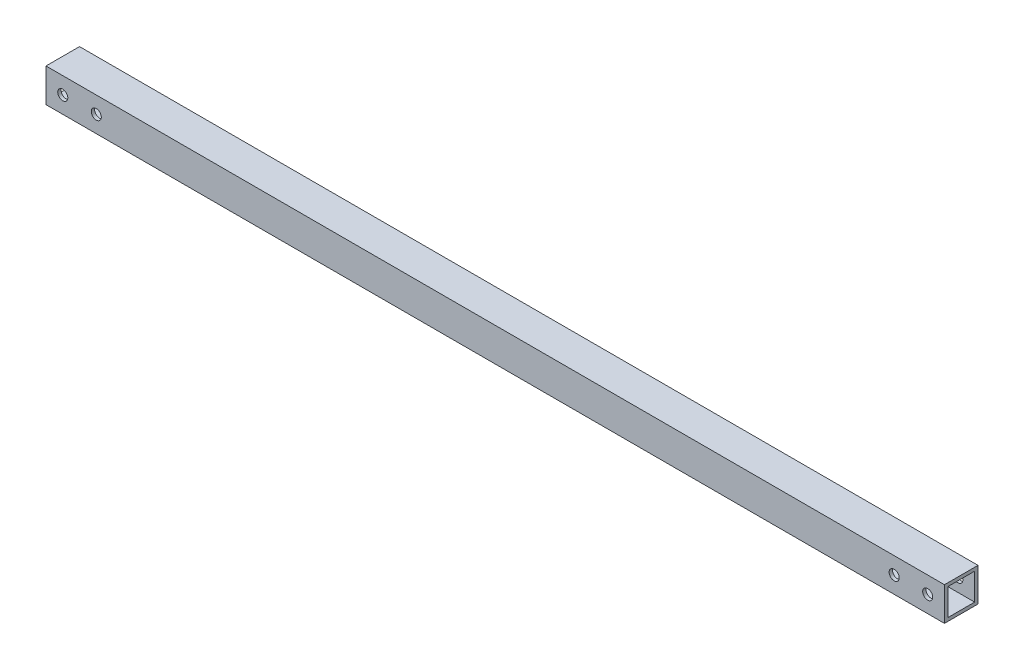
from build123d import *

# Parameters (mm, degrees)
SKETCH1_W           = 20
SKETCH1_H           = 20
SKETCH1_W_2         = 16
SKETCH1_H_2         = 16
BOSS_EXTRUDE1_DEPTH = 268
SKETCH2_R           = 3
CUT_EXTRUDE1_DEPTH  = 269.931217972


with BuildPart() as part:
    # Sketch1 → Boss-Extrude1 (new, symmetric)
    with BuildSketch(Plane(origin=(0, 0, 0), x_dir=(0, 0, -1), z_dir=(1, 0, 0))):
        Rectangle(SKETCH1_W, SKETCH1_H)
        Rectangle(SKETCH1_W_2, SKETCH1_H_2, mode=Mode.SUBTRACT)
    extrude(amount=BOSS_EXTRUDE1_DEPTH, both=True)

    # Sketch2 → Cut-Extrude1 (cut, through all)
    with BuildSketch(Plane.XY.offset(10)):
        with Locations((258, 0)):
            Circle(SKETCH2_R)
        with Locations((238, 0)):
            Circle(SKETCH2_R)
        with Locations((-238, 0)):
            Circle(SKETCH2_R)
        with Locations((-258, 0)):
            Circle(SKETCH2_R)
    extrude(amount=-CUT_EXTRUDE1_DEPTH, mode=Mode.SUBTRACT)


solid = part.part
